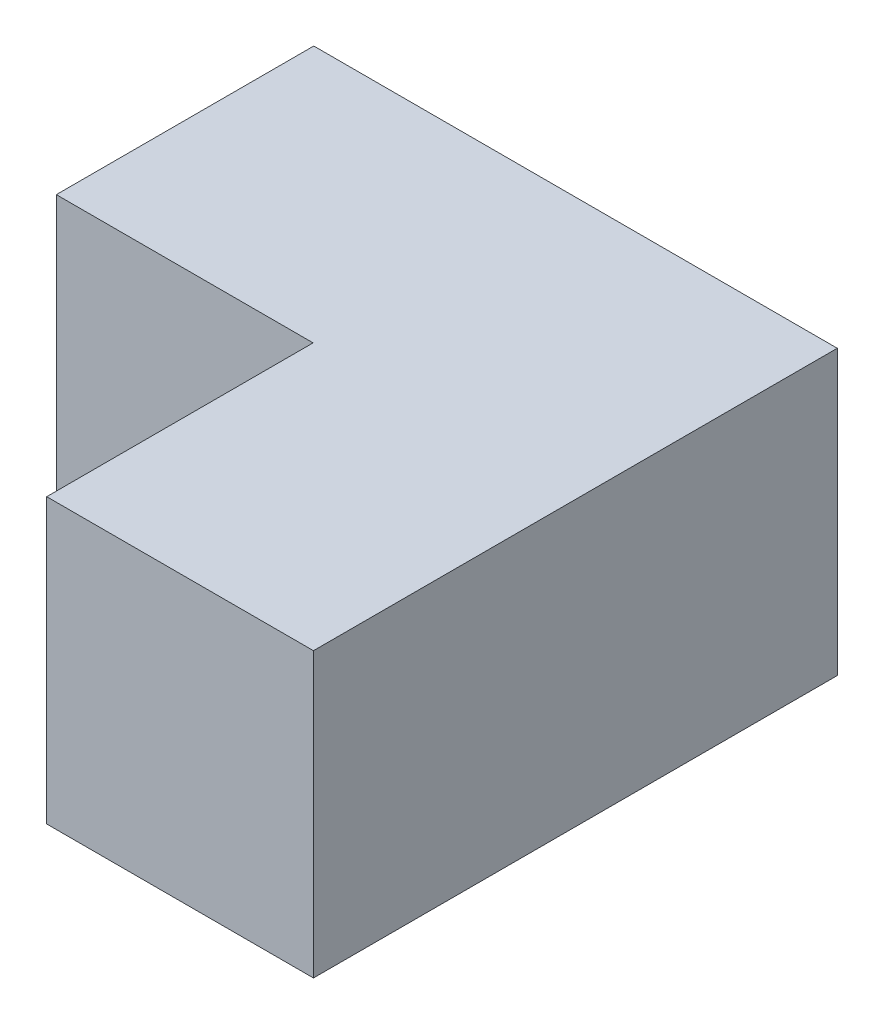
from build123d import *

# Parameters (mm, degrees)
BOSS_EXTRUDE1_DEPTH     = 25.4
BOSS_EXTRUDE1_2_DEPTH   = 25.4
CUT_EXTRUDE1_DEPTH      = 281.867791968
CUT_EXTRUDE1_DEPTH_BACK = 281.867791968
SKETCH2_OUTSIDE_W       = 232.096
SKETCH2_OUTSIDE_H       = 277.199
SKETCH2_OUTSIDE_W_2     = 46.910236734
SKETCH2_OUTSIDE_H_2     = 46.937556504


with BuildPart() as part:
    # Sketch1 → Boss-Extrude1 (new body)
    with BuildSketch(Plane(origin=(0, 0, 0), x_dir=(1, 0, 0), z_dir=(0, 1, 0))):
        with BuildLine():
            Line((0, 80.02759766), (0, 219.067642019))
            Line((0, 219.067642019), (103.040086398, 219.067642019))
            Line((103.040086398, 219.067642019), (103.040086398, 195.999460881))
            Line((103.040086398, 195.999460881), (23.011829096, 195.999460881))
            Line((23.011829096, 195.999460881), (23.011829096, 161.013213822))
            ThreePointArc((23.011829096, 161.013213822), (101.985495584, 126.901824422), (136.744902109, 48.211224327))
            ThreePointArc((136.744902109, 48.211224327), (146.280346481, 62.911008862), (150.026111113, 80.02759766))
            Line((150.026111113, 80.02759766), (150.026111113, 148.011746996))
            Line((150.026111113, 148.011746996), (172.974333949, 148.011746996))
            Line((172.974333949, 148.011746996), (172.974333949, 80.02759766))
            ThreePointArc((172.974333949, 80.02759766), (86.487166974, 0.037389651), (0, 80.02759766))
        make_face()
        with BuildLine():
            Line((23.011829096, 136.058182002), (23.011829096, 80.02759766))
            ThreePointArc((23.011829096, 80.02759766), (54.48283159, 31.69310754), (112.066438029, 28.410547154))
            ThreePointArc((112.066438029, 28.410547154), (90.841729512, 101.512108787), (23.011829096, 136.058182002))
        make_face(mode=Mode.SUBTRACT)
    extrude(amount=BOSS_EXTRUDE1_DEPTH)

    # Sketch2 outside → Cut-Extrude1 (cut, two sides: drawn at the far end of the back side and taken through both)
    with BuildSketch(Plane(origin=(0, 25.4, 0), x_dir=(1, 0, 0), z_dir=(0, 1, 0)).offset(-CUT_EXTRUDE1_DEPTH_BACK)):
        with Locations((86.964, 109.5525)):
            Rectangle(SKETCH2_OUTSIDE_W, SKETCH2_OUTSIDE_H)
        with Locations((150.472811492, 195.598863767)):
            Rectangle(SKETCH2_OUTSIDE_W_2, SKETCH2_OUTSIDE_H_2, mode=Mode.SUBTRACT)
    extrude(amount=CUT_EXTRUDE1_DEPTH + CUT_EXTRUDE1_DEPTH_BACK, mode=Mode.SUBTRACT)


with BuildPart() as body_2:
    # Sketch1 → Boss-Extrude1 2 (new body)
    with BuildSketch(Plane(origin=(0, 0, 0), x_dir=(1, 0, 0), z_dir=(0, 1, 0))):
        Polygon((173.927929859, 172.130085515), (150.026111113, 172.130085515), (150.026111113, 195.999460881), (127.017693125, 195.999460881), (127.017693125, 219.067642019), (173.927929859, 219.067642019), align=None)
    extrude(amount=BOSS_EXTRUDE1_2_DEPTH)


solid = body_2.part
